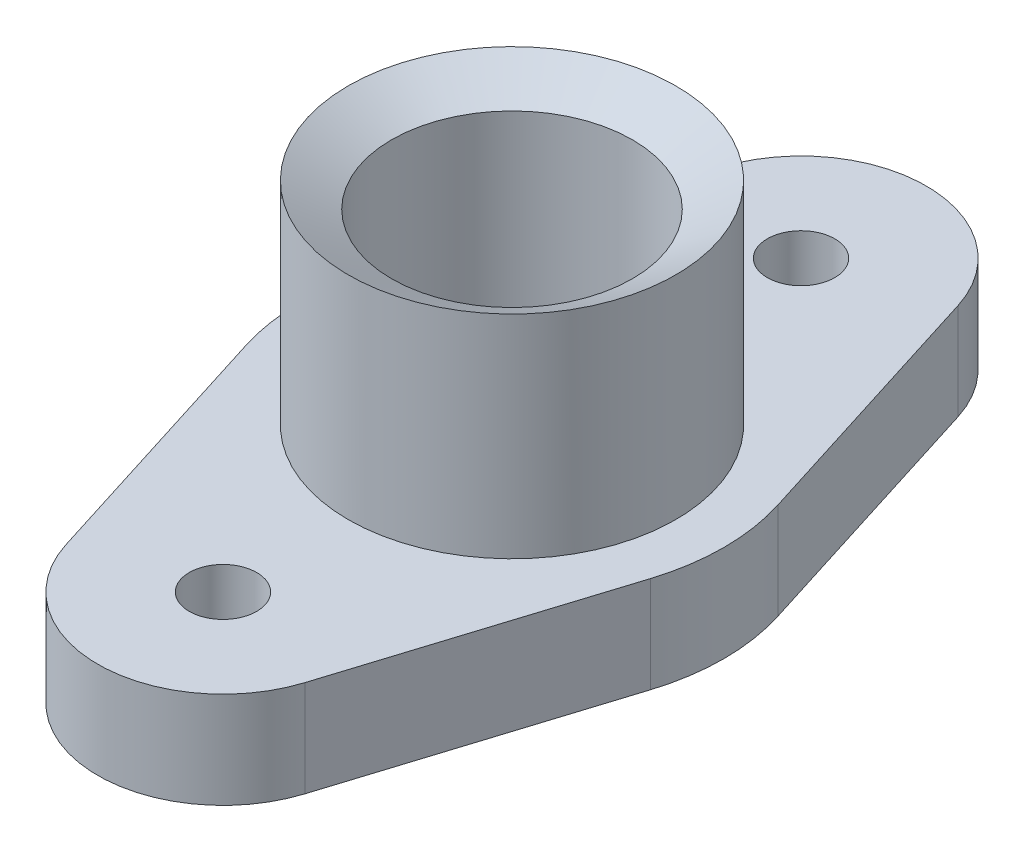
from build123d import *

# Parameters (mm, degrees)
EXTRUDE_1_DEPTH = 10
SKETCH_2_R      = 17
EXTRUDE_2_DEPTH = 22
MM_1_D          = 7
MM_2_D          = 25


with BuildPart() as part:
    # 草图1 → 凸台-拉伸1 (new body)
    with BuildSketch(Plane(origin=(0, 0, 0), x_dir=(1, 0, 0), z_dir=(0, 1, 0))):
        with BuildLine():
            Line((-12.401209618, 33.9), (-20.986662431, 6.6))
            ThreePointArc((-20.986662431, 6.6), (0, -22), (20.986662431, 6.6))
            Line((20.986662431, 6.6), (12.401209618, 33.9))
            ThreePointArc((12.401209618, 33.9), (0, 43), (-12.401209618, 33.9))
        make_face()
        with BuildLine():
            Line((12.401209618, -33.9), (20.986662431, -6.6))
            ThreePointArc((20.986662431, -6.6), (0, 22), (-20.986662431, -6.6))
            Line((-20.986662431, -6.6), (-12.401209618, -33.9))
            ThreePointArc((-12.401209618, -33.9), (0, -43), (12.401209618, -33.9))
        make_face()
    extrude(amount=EXTRUDE_1_DEPTH)

    # 草图2 → 凸台-拉伸2 (add)
    with BuildSketch(Plane(origin=(0, 10, 0), x_dir=(1, 0, 0), z_dir=(0, 1, 0))):
        with Locations(Location((0, 0, 0), (0, 0, 270))):
            Circle(SKETCH_2_R)
    extrude(amount=EXTRUDE_2_DEPTH)

    # 大小mm 暗销孔1 (through all)
    with Locations(Plane(origin=(0, 10, -30), x_dir=(0, 0, 1), z_dir=(0, 1, 0))):
        with Locations((0, 0), (60, 0)):
            Hole(MM_1_D / 2)

    # 大小mm 暗销孔2 (through all)
    with Locations(Plane.ZX.offset(32)):
        with Locations((0, 0)):
            Hole(MM_2_D / 2)

    # 草图5 → 切除-旋转1 (revolve, cut)
    with BuildSketch(Plane.XY, mode=Mode.PRIVATE) as cut_revolve_1_sk:
        Polygon((0, 22.185045424), (17, 32), (17, 40.592960663), (0, 40.592960663), align=None)
    revolve(cut_revolve_1_sk.sketch.rotate(Axis((0, 32, 0), (0, -1, 0)), 180), axis=Axis((0, 32, 0), (0, -1, 0)), mode=Mode.SUBTRACT)


solid = part.part
